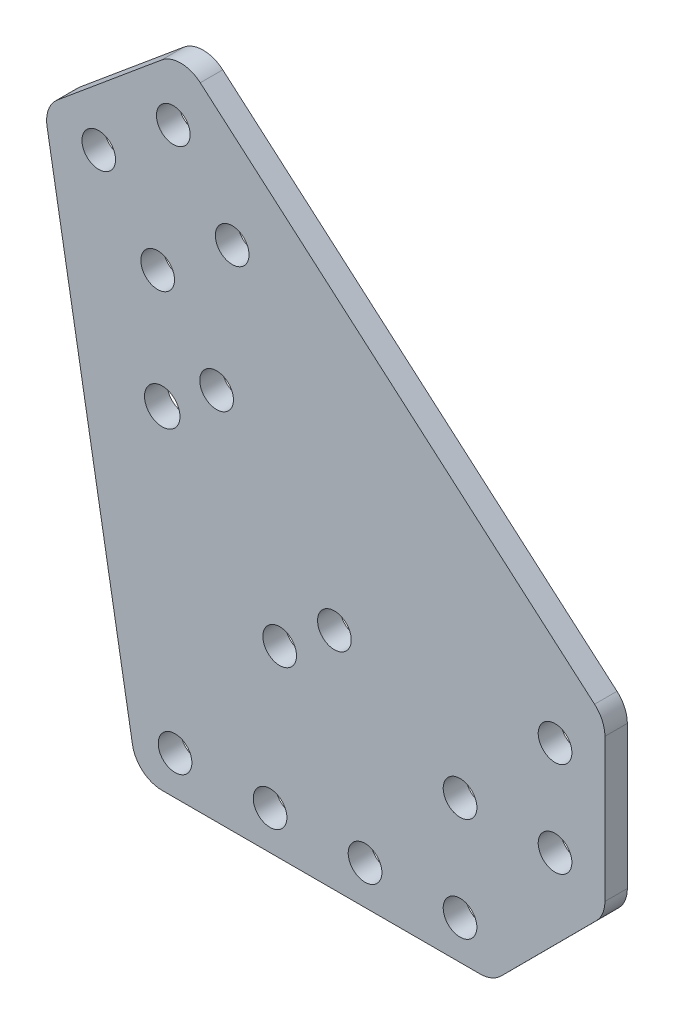
from build123d import *

# Parameters (mm, degrees)
SKETCH_2_R      = 2.25
SKETCH_2_R_2    = 2.368301068
EXTRUDE_2_DEPTH = 3
FILLET_2_R      = 4


with BuildPart() as part:
    # 草图2 → 凸台-拉伸2 (new body)
    with BuildSketch(Plane.XY):
        Polygon((-167.590783161, -24.567963054), (-179.98483895, 46.885925983), (-161.669401762, 62.135536129), (-105.010365497, 13.121555122), (-105.010365497, -9.480363054), (-120.053839996, -24.567963054), align=None)
        with Locations((-154.836997815, 43.253183089)):
            Circle(SKETCH_2_R, mode=Mode.SUBTRACT)
        with Locations((-164.79992885, 35.377270114)):
            Circle(SKETCH_2_R, mode=Mode.SUBTRACT)
        with Locations((-162.712910791, 53.216114124)):
            Circle(SKETCH_2_R, mode=Mode.SUBTRACT)
        with Locations((-172.675841825, 45.340201148)):
            Circle(SKETCH_2_R, mode=Mode.SUBTRACT)
        with Locations((-111.676854941, 7.182036946)):
            Circle(SKETCH_2_R, mode=Mode.SUBTRACT)
        with Locations((-124.376854941, -5.517963054)):
            Circle(SKETCH_2_R, mode=Mode.SUBTRACT)
        with Locations((-124.376854941, -19.386363054)):
            Circle(SKETCH_2_R, mode=Mode.SUBTRACT)
        with Locations((-137.076854941, -19.386363054)):
            Circle(SKETCH_2_R, mode=Mode.SUBTRACT)
        with Locations((-149.776854941, -19.386363054)):
            Circle(SKETCH_2_R, mode=Mode.SUBTRACT)
        with Locations((-162.476854941, -19.386363054)):
            Circle(SKETCH_2_R, mode=Mode.SUBTRACT)
        with Locations((-141.172189922, 5.48847701)):
            Circle(SKETCH_2_R, mode=Mode.SUBTRACT)
        with Locations((-148.489740206, 0)):
            Circle(SKETCH_2_R, mode=Mode.SUBTRACT)
        with Locations((-156.924015874, 25.414339079)):
            Circle(SKETCH_2_R, mode=Mode.SUBTRACT)
        with Locations((-164.189999825, 19.901668358)):
            Circle(SKETCH_2_R_2, mode=Mode.SUBTRACT)
        with Locations((-111.676854941, -5.517963054)):
            Circle(SKETCH_2_R, mode=Mode.SUBTRACT)
    extrude(amount=EXTRUDE_2_DEPTH)

    # 圆角2
    fillet_2_edges = [part.edges().sort_by_distance(p)[0] for p in [
        (-120.053839996, -24.567963054, 1.5),
        (-167.590783161, -24.567963054, 1.5),
        (-179.98483895, 46.885925983, 1.5),
        (-161.669401762, 62.135536129, 1.5),
        (-105.010365497, 13.121555122, 1.5),
        (-105.010365497, -9.480363054, 1.5),
    ]]
    fillet(fillet_2_edges, radius=FILLET_2_R)


solid = part.part
